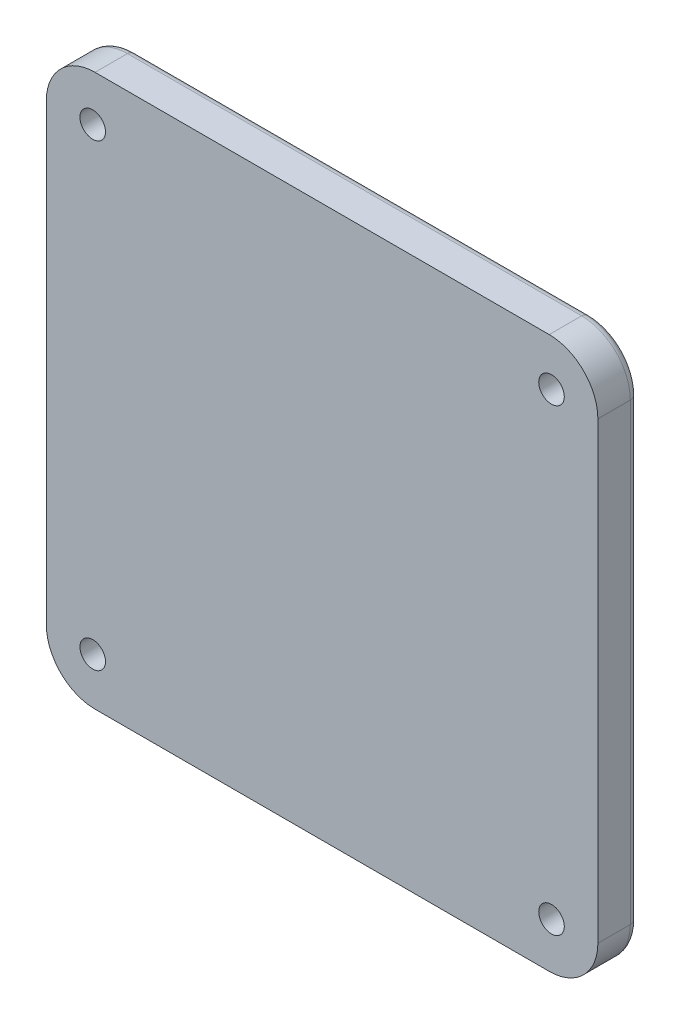
from build123d import *

# Parameters (mm, degrees)
SKETCH1_R           = 1.575
BOSS_EXTRUDE1_DEPTH = 5
FILLET1_R           = 1


with BuildPart() as part:
    # Sketch1 → Boss-Extrude1 (new body)
    with BuildSketch(Plane(origin=(0, 0, -97.507071393), x_dir=(-1, 0, 0), z_dir=(0, 0, -1))):
        with BuildLine():
            Line((-61.072792821, 13.25870832), (-117.072792821, 13.25870832))
            ThreePointArc((-117.072792821, 13.25870832), (-121.315433508, 15.016067633), (-123.072792821, 19.25870832))
            Line((-123.072792821, 19.25870832), (-123.072792821, 75.25870832))
            ThreePointArc((-123.072792821, 75.25870832), (-121.315433508, 79.501349008), (-117.072792821, 81.25870832))
            Line((-117.072792821, 81.25870832), (-61.072792821, 81.25870832))
            ThreePointArc((-61.072792821, 81.25870832), (-56.830152134, 79.501349008), (-55.072792821, 75.25870832))
            Line((-55.072792821, 75.25870832), (-55.072792821, 19.25870832))
            ThreePointArc((-55.072792821, 19.25870832), (-56.830152134, 15.016067633), (-61.072792821, 13.25870832))
        make_face()
        with Locations((-117.357064069, 75.542979568)):
            Circle(SKETCH1_R, mode=Mode.SUBTRACT)
        with Locations((-60.788521574, 75.542979568)):
            Circle(SKETCH1_R, mode=Mode.SUBTRACT)
        with Locations((-60.788521574, 18.974437073)):
            Circle(SKETCH1_R, mode=Mode.SUBTRACT)
        with Locations((-117.357064069, 18.974437073)):
            Circle(SKETCH1_R, mode=Mode.SUBTRACT)
    extrude(amount=BOSS_EXTRUDE1_DEPTH)

    # Fillet1
    fillet1_edges = [part.edges().sort_by_distance(p)[0] for p in [
        (56.830152134, 15.016067633, -102.507071393),
        (55.072792821, 47.25870832, -102.507071393),
        (56.830152134, 79.501349008, -102.507071393),
        (89.072792821, 81.25870832, -102.507071393),
        (121.315433508, 79.501349008, -102.507071393),
        (123.072792821, 47.25870832, -102.507071393),
        (121.315433508, 15.016067633, -102.507071393),
        (89.072792821, 13.25870832, -102.507071393),
    ]]
    fillet(fillet1_edges, radius=FILLET1_R)


solid = part.part
